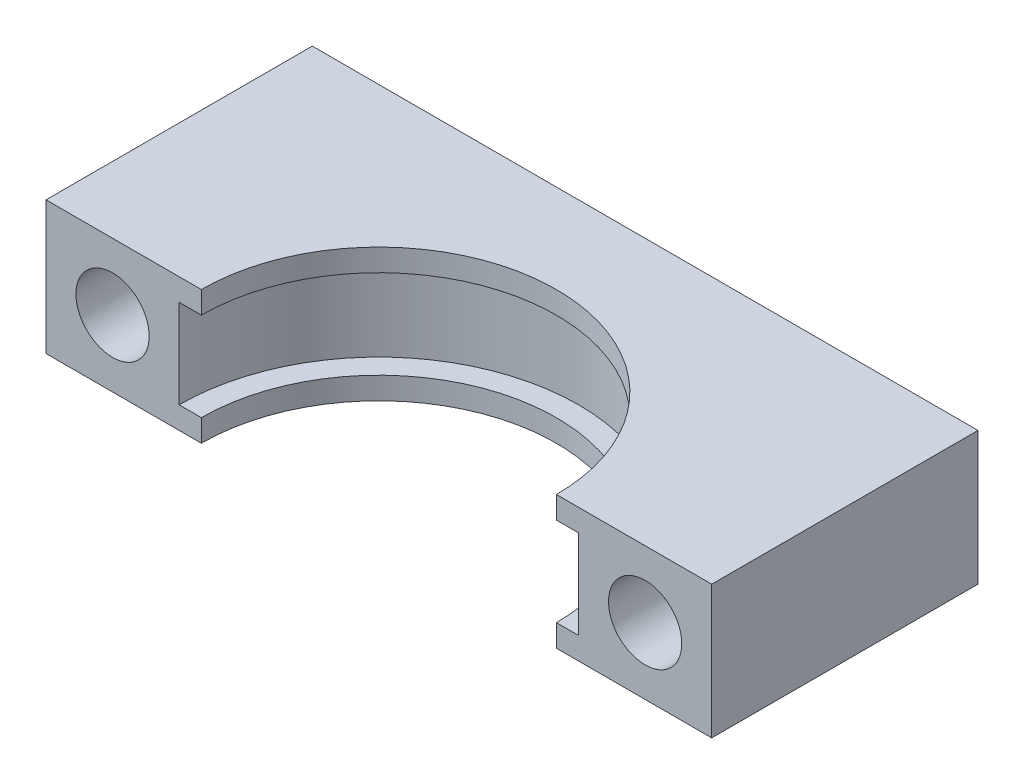
from build123d import *

# Parameters (mm, degrees)
SKETCH_1_W          = 30
SKETCH_1_H          = 12
EXTRUDE_1_DEPTH     = 6
CUT_EXTRUDE_2_REACH = 22.125
SKETCH_4_R          = 1.65


with BuildPart() as part:
    # 草图1 → 凸台-拉伸1 (new body)
    with BuildSketch(Plane(origin=(0, 0, 0), x_dir=(1, 0, 0), z_dir=(0, 1, 0))):
        with Locations((0, 6)):
            Rectangle(SKETCH_1_W, SKETCH_1_H)
    extrude(amount=EXTRUDE_1_DEPTH)

    # 草图2 → 切除-旋转1 (revolve, cut)
    with BuildSketch(Plane.XY):
        Polygon((-8, 0), (0, 0), (0, 3), (-9, 3), (-9, 1), (-8, 1), align=None)
        Polygon((-9, 3), (0, 3), (0, 6), (-8, 6), (-8, 5), (-9, 5), align=None)
    revolve(axis=Axis((0, 0, 0), (0, 1, 0)), mode=Mode.SUBTRACT)

    # 草图4 → 切除-拉伸2 (cut, up to next)
    with BuildSketch(Plane(origin=(0, 0, -12), x_dir=(-1, 0, 0), z_dir=(0, 0, -1)), mode=Mode.PRIVATE) as cut_extrude_2_sk1:
        with Locations((-12, 3)):
            Circle(SKETCH_4_R)
    cut_extrude_2_tool1 = extrude(cut_extrude_2_sk1.sketch, amount=-CUT_EXTRUDE_2_REACH, mode=Mode.PRIVATE) & part.part
    cut_extrude_2 = cut_extrude_2_tool1.solids().sort_by_distance((12, 3, -12))[0]
    add(cut_extrude_2, mode=Mode.SUBTRACT)

    # 镜向1: 切除-拉伸2 across plane
    add(cut_extrude_2.mirror(Plane(origin=(0, 0, 0), x_dir=(0, 0, 1), z_dir=(1, 0, 0))), mode=Mode.SUBTRACT)


solid = part.part
